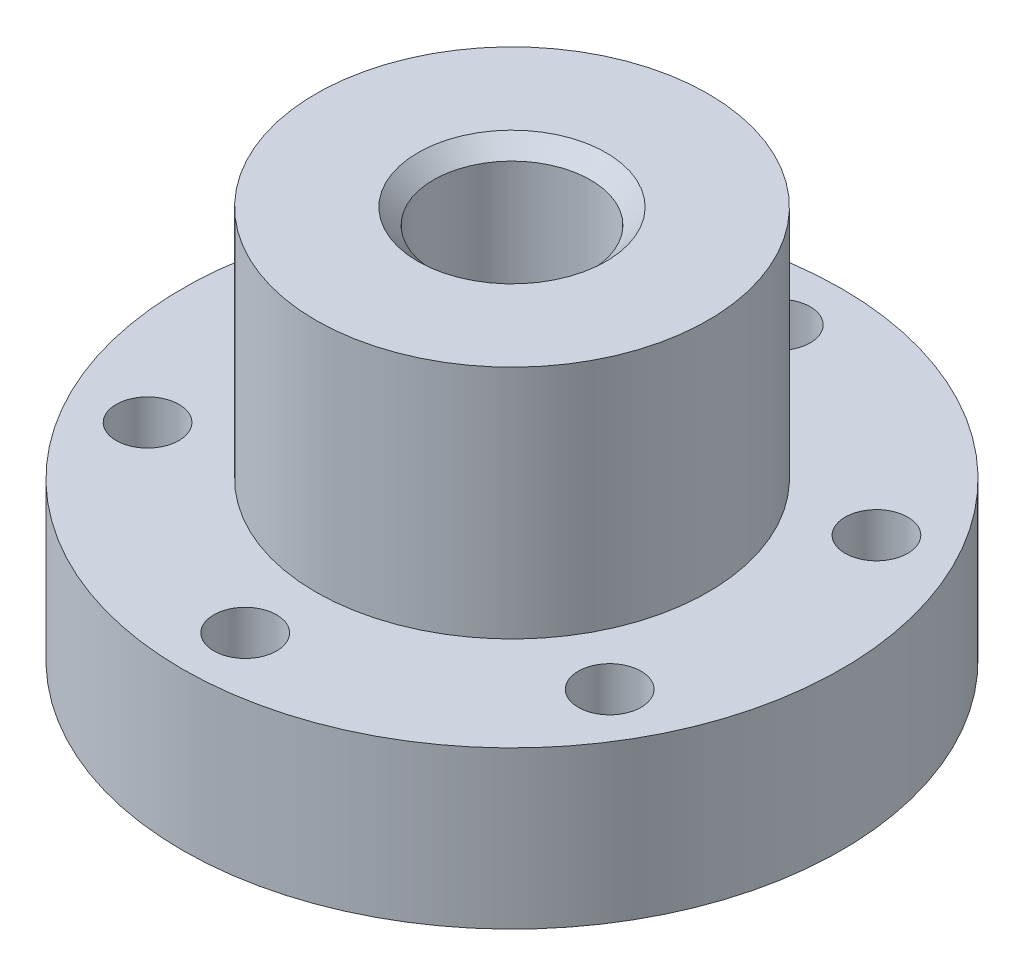
from build123d import *

# Parameters (mm, degrees)
SKETCH1_R           = 21
SKETCH1_R_2         = 2
BOSS_EXTRUDE1_DEPTH = 10
SKETCH2_R           = 12.5
BOSS_EXTRUDE2_DEPTH = 15
SKETCH3_R           = 5
CUT_EXTRUDE1_DEPTH  = 39.820097888
CHAMFER1_SIZE       = 1


with BuildPart() as part:
    # Sketch1 → Boss-Extrude1 (new body)
    with BuildSketch(Plane(origin=(0, 0, 0), x_dir=(1, 0, 0), z_dir=(0, 1, 0))):
        with Locations(Location((0, 0, 0), (0, 0, 270))):
            Circle(SKETCH1_R)
        with Locations(Location((0, 17, 0), (0, 0, 270))):
            Circle(SKETCH1_R_2, mode=Mode.SUBTRACT)
        with Locations(Location((14.722431864, 8.5, 0), (0, 0, 270))):
            Circle(SKETCH1_R_2, mode=Mode.SUBTRACT)
        with Locations(Location((14.722431864, -8.5, 0), (0, 0, 270))):
            Circle(SKETCH1_R_2, mode=Mode.SUBTRACT)
        with Locations(Location((0, -17, 0), (0, 0, 270))):
            Circle(SKETCH1_R_2, mode=Mode.SUBTRACT)
        with Locations(Location((-14.722431864, -8.5, 0), (0, 0, 270))):
            Circle(SKETCH1_R_2, mode=Mode.SUBTRACT)
        with Locations(Location((-14.722431864, 8.5, 0), (0, 0, 270))):
            Circle(SKETCH1_R_2, mode=Mode.SUBTRACT)
    extrude(amount=BOSS_EXTRUDE1_DEPTH)

    # Sketch2 → Boss-Extrude2 (add)
    with BuildSketch(Plane(origin=(0, 10, 0), x_dir=(1, 0, 0), z_dir=(0, 1, 0))):
        with Locations(Location((0, 0, 0), (0, 0, 270))):
            Circle(SKETCH2_R)
    extrude(amount=BOSS_EXTRUDE2_DEPTH)

    # Sketch3 → Cut-Extrude1 (cut, through all)
    with BuildSketch(Plane(origin=(0, 25, 0), x_dir=(1, 0, 0), z_dir=(0, 1, 0))):
        with Locations(Location((0, 0, 0), (0, 0, 270))):
            Circle(SKETCH3_R)
    extrude(amount=-CUT_EXTRUDE1_DEPTH, mode=Mode.SUBTRACT)

    # Chamfer1
    chamfer1_edges = [part.edges().sort_by_distance(p)[0] for p in [
        (0, 0, -5),
        (0, 25, -5),
    ]]
    chamfer(chamfer1_edges, length=CHAMFER1_SIZE)


solid = part.part
